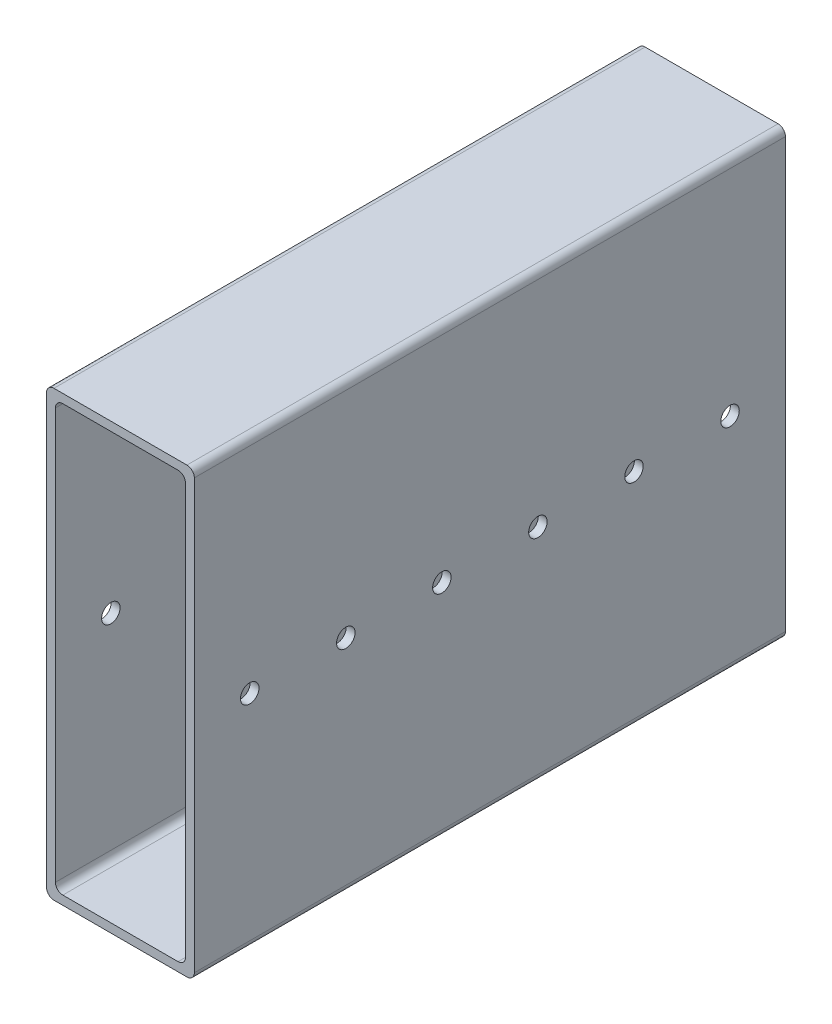
from build123d import *

# Parameters (mm, degrees)
BOSS_EXTRUDE1_DEPTH = 203.2
SHELL1_T            = -3.048
FILLET1_R           = 2.54
SKETCH2_R           = 3.175
CUT_EXTRUDE1_DEPTH  = 203.2


with BuildPart() as part:
    # Sketch1 → Boss-Extrude1 (new body)
    with BuildSketch(Plane.XY):
        with BuildLine():
            Line((-11.300558575, 134.809128263), (34.419441425, 134.809128263))
            ThreePointArc((34.419441425, 134.809128263), (36.215492649, 134.065179487), (36.959441425, 132.269128263))
            Line((36.959441425, 132.269128263), (36.959441425, -15.050871737))
            ThreePointArc((36.959441425, -15.050871737), (36.215492649, -16.846922961), (34.419441425, -17.590871737))
            Line((34.419441425, -17.590871737), (-11.300558575, -17.590871737))
            ThreePointArc((-11.300558575, -17.590871737), (-13.096609799, -16.846922961), (-13.840558575, -15.050871737))
            Line((-13.840558575, -15.050871737), (-13.840558575, 132.269128263))
            ThreePointArc((-13.840558575, 132.269128263), (-13.096609799, 134.065179487), (-11.300558575, 134.809128263))
        make_face()
    extrude(amount=BOSS_EXTRUDE1_DEPTH)

    # Shell1
    shell1_openings = [part.faces().sort_by_distance(p)[0] for p in [
        (11.559441425, 58.609128263, 203.2),
        (11.559441425, 58.609128263, 0),
    ]]
    offset(amount=SHELL1_T, openings=shell1_openings, kind=Kind.INTERSECTION)

    # Fillet1
    fillet1_edges = [part.edges().sort_by_distance(p)[0] for p in [
        (33.911441425, -14.542871737, 101.6),
        (33.911441425, 131.761128263, 101.6),
        (-10.792558575, 131.761128263, 101.6),
        (-10.792558575, -14.542871737, 101.6),
    ]]
    fillet(fillet1_edges, radius=FILLET1_R)

    # Sketch2 → Cut-Extrude1 (cut)
    with BuildSketch(Plane(origin=(36.959441425, 0, 0), x_dir=(0, 0, -1), z_dir=(1, 0, 0))):
        with Locations(Location((-52.07, 58.609128263, 0), (0, 0, 90))):
            Circle(SKETCH2_R)
        with Locations(Location((-85.09, 58.609128263, 0), (0, 0, 90))):
            Circle(SKETCH2_R)
        with Locations(Location((-118.11, 58.609128263, 0), (0, 0, 90))):
            Circle(SKETCH2_R)
        with Locations(Location((-151.13, 58.609128263, 0), (0, 0, 90))):
            Circle(SKETCH2_R)
        with Locations(Location((-184.15, 58.609128263, 0), (0, 0, 90))):
            Circle(SKETCH2_R)
        with Locations(Location((-19.05, 58.609128263, 0), (0, 0, 90))):
            Circle(SKETCH2_R)
    extrude(amount=-CUT_EXTRUDE1_DEPTH, mode=Mode.SUBTRACT)


solid = part.part
